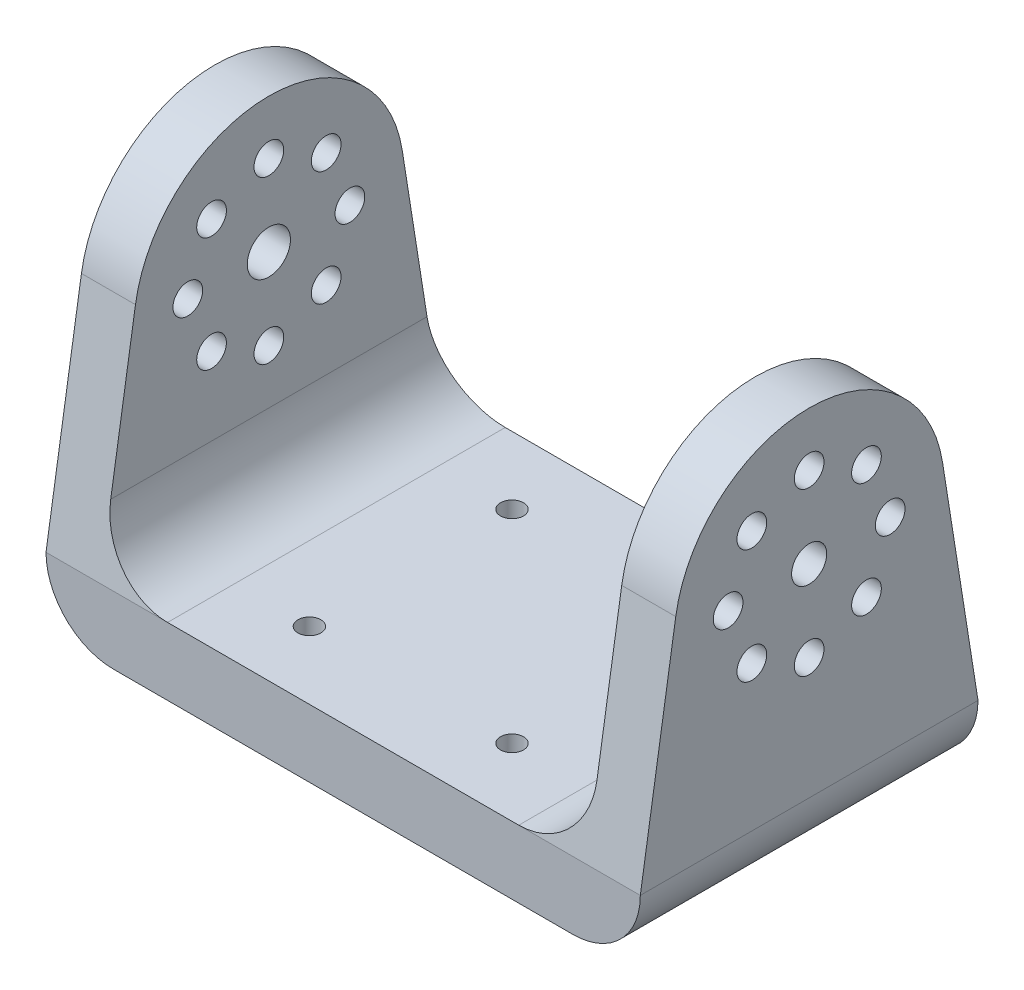
from build123d import *

# Parameters (mm, degrees)
SKETCH_1_W          = 44
SKETCH_1_H          = 25
EXTRUDE_1_DEPTH     = 5
SKETCH_2_R          = 1.1
SKETCH_2_R_2        = 1.6
EXTRUDE_2_DEPTH     = 4
EXTRUDE_START       = -4
SKETCH_3_R          = 1.3
SKETCH_3_R_2        = 1.1
EXTRUDE_3_DEPTH     = 4
FILLET_1_R          = 5
SKETCH_4_R          = 0.85
CUT_EXTRUDE_1_DEPTH = 5


with BuildPart() as part:
    # ｽｹｯﾁ1 → ﾎﾞｽ - 押し出し1 (new body)
    with BuildSketch(Plane(origin=(0, 0, 0), x_dir=(1, 0, 0), z_dir=(0, 1, 0))):
        with Locations((0, 12.5)):
            Rectangle(SKETCH_1_W, SKETCH_1_H)
    extrude(amount=EXTRUDE_1_DEPTH)

    # ｽｹｯﾁ2 → ﾎﾞｽ - 押し出し2 (add)
    with BuildSketch(Plane.ZY.offset(22)):
        with BuildLine():
            Line((-25, 5), (0, 5))
            Line((0, 5), (-2.623078099, 21.564101584))
            ThreePointArc((-2.623078099, 21.564101584), (-12.5, 30), (-22.376921901, 21.564101584))
            Line((-22.376921901, 21.564101584), (-25, 5))
        make_face()
        with Locations((-12.5, 26)):
            Circle(SKETCH_2_R, mode=Mode.SUBTRACT)
        with Locations((-8.257359313, 24.242640687)):
            Circle(SKETCH_2_R, mode=Mode.SUBTRACT)
        with Locations((-6.5, 20)):
            Circle(SKETCH_2_R, mode=Mode.SUBTRACT)
        with Locations((-8.257359313, 15.757359313)):
            Circle(SKETCH_2_R, mode=Mode.SUBTRACT)
        with Locations((-12.5, 14)):
            Circle(SKETCH_2_R, mode=Mode.SUBTRACT)
        with Locations((-16.742640687, 15.757359313)):
            Circle(SKETCH_2_R, mode=Mode.SUBTRACT)
        with Locations((-18.5, 20)):
            Circle(SKETCH_2_R, mode=Mode.SUBTRACT)
        with Locations((-16.742640687, 24.242640687)):
            Circle(SKETCH_2_R, mode=Mode.SUBTRACT)
        with Locations((-12.5, 20)):
            Circle(SKETCH_2_R_2, mode=Mode.SUBTRACT)
    extrude(amount=-EXTRUDE_2_DEPTH)

    # ｽｹｯﾁ3 → ﾎﾞｽ - 押し出し3 (add)
    with BuildSketch(Plane(origin=(22, 0, 0), x_dir=(0, 0, -1), z_dir=(1, 0, 0)).offset(EXTRUDE_START)):
        with BuildLine():
            Line((0, 5), (2.623078099, 21.564101584))
            ThreePointArc((2.623078099, 21.564101584), (12.5, 30), (22.376921901, 21.564101584))
            Line((22.376921901, 21.564101584), (25, 5))
            Line((25, 5), (0, 5))
        make_face()
        with Locations((12.5, 20)):
            Circle(SKETCH_3_R, mode=Mode.SUBTRACT)
        with Locations(Location((8.257359313, 15.757359313, 0), (0, 0, 180))):
            Circle(SKETCH_3_R_2, mode=Mode.SUBTRACT)
        with Locations(Location((12.5, 14, 0), (0, 0, 180))):
            Circle(SKETCH_3_R_2, mode=Mode.SUBTRACT)
        with Locations(Location((16.742640687, 15.757359313, 0), (0, 0, 180))):
            Circle(SKETCH_3_R_2, mode=Mode.SUBTRACT)
        with Locations(Location((18.5, 20, 0), (0, 0, 180))):
            Circle(SKETCH_3_R_2, mode=Mode.SUBTRACT)
        with Locations(Location((16.742640687, 24.242640687, 0), (0, 0, 180))):
            Circle(SKETCH_3_R_2, mode=Mode.SUBTRACT)
        with Locations(Location((12.5, 26, 0), (0, 0, 180))):
            Circle(SKETCH_3_R_2, mode=Mode.SUBTRACT)
        with Locations(Location((8.257359313, 24.242640687, 0), (0, 0, 180))):
            Circle(SKETCH_3_R_2, mode=Mode.SUBTRACT)
        with Locations(Location((6.5, 20, 0), (0, 0, 180))):
            Circle(SKETCH_3_R_2, mode=Mode.SUBTRACT)
    extrude(amount=EXTRUDE_3_DEPTH)

    # ﾌｨﾚｯﾄ1
    fillet_1_edges = [part.edges().sort_by_distance(p)[0] for p in [
        (18, 5, -12.5),
        (-18, 5, -12.5),
        (22, 0, -12.5),
        (-22, 0, -12.5),
    ]]
    fillet(fillet_1_edges, radius=FILLET_1_R)

    # ｽｹｯﾁ4 → ｶｯﾄ - 押し出し1 (cut)
    with BuildSketch(Plane(origin=(0, 5, 0), x_dir=(1, 0, 0), z_dir=(0, 1, 0))):
        with Locations(Location((-7.5, 20, 0), (0, 0, 270))):
            Circle(SKETCH_4_R)
        with Locations(Location((7.5, 20, 0), (0, 0, 270))):
            Circle(SKETCH_4_R)
        with Locations(Location((7.5, 5, 0), (0, 0, 270))):
            Circle(SKETCH_4_R)
        with Locations(Location((-7.5, 5, 0), (0, 0, 270))):
            Circle(SKETCH_4_R)
    extrude(amount=-CUT_EXTRUDE_1_DEPTH, mode=Mode.SUBTRACT)


solid = part.part
